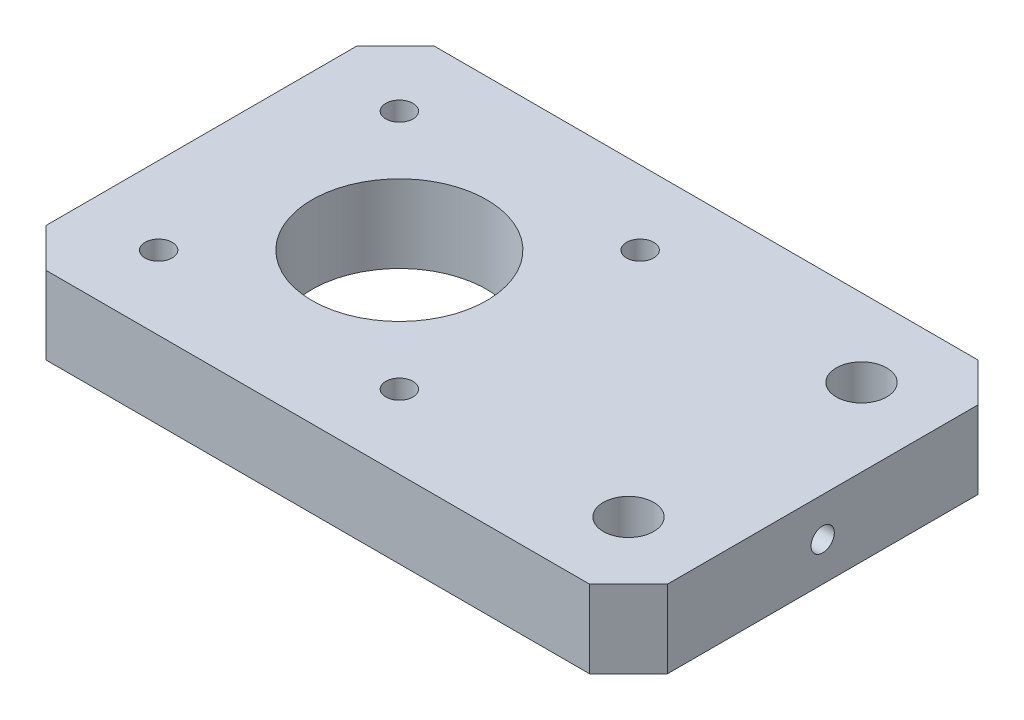
from build123d import *

# Parameters (mm, degrees)
SKETCH1_W           = 80
SKETCH1_H           = 50
SKETCH1_R           = 1.75
SKETCH1_R_2         = 11.25
SKETCH1_R_3         = 3.25
BOSS_EXTRUDE1_DEPTH = 10
SKETCH2_R           = 1.5
CUT_EXTRUDE1_DEPTH  = 15
CHAMFER1_SIZE       = 5


with BuildPart() as part:
    # Sketch1 → Boss-Extrude1 (new body)
    with BuildSketch(Plane(origin=(0, 0, 0), x_dir=(1, 0, 0), z_dir=(0, 1, 0))):
        with Locations((40, 0)):
            Rectangle(SKETCH1_W, SKETCH1_H)
        with Locations(Location((10, 15.5, 0), (0, 0, 270))):
            Circle(SKETCH1_R, mode=Mode.SUBTRACT)
        with Locations(Location((10, -15.5, 0), (0, 0, 270))):
            Circle(SKETCH1_R, mode=Mode.SUBTRACT)
        with Locations(Location((25.5, 0, 0), (0, 0, 270))):
            Circle(SKETCH1_R_2, mode=Mode.SUBTRACT)
        with Locations(Location((41, 15.5, 0), (0, 0, 270))):
            Circle(SKETCH1_R, mode=Mode.SUBTRACT)
        with Locations(Location((41, -15.5, 0), (0, 0, 270))):
            Circle(SKETCH1_R, mode=Mode.SUBTRACT)
        with Locations(Location((70, 15, 0), (0, 0, 270))):
            Circle(SKETCH1_R_3, mode=Mode.SUBTRACT)
        with Locations(Location((70, -15, 0), (0, 0, 270))):
            Circle(SKETCH1_R_3, mode=Mode.SUBTRACT)
    extrude(amount=BOSS_EXTRUDE1_DEPTH)

    # Sketch2 → Cut-Extrude1 (cut)
    with BuildSketch(Plane(origin=(80, 0, 0), x_dir=(0, 0, -1), z_dir=(1, 0, 0))):
        with Locations((0, 5)):
            Circle(SKETCH2_R)
    extrude(amount=-CUT_EXTRUDE1_DEPTH, mode=Mode.SUBTRACT)

    # Chamfer1
    chamfer1_edges = [part.edges().sort_by_distance(p)[0] for p in [
        (0, 5, -25),
        (80, 5, -25),
        (80, 5, 25),
        (0, 5, 25),
    ]]
    chamfer(chamfer1_edges, length=CHAMFER1_SIZE)


solid = part.part
